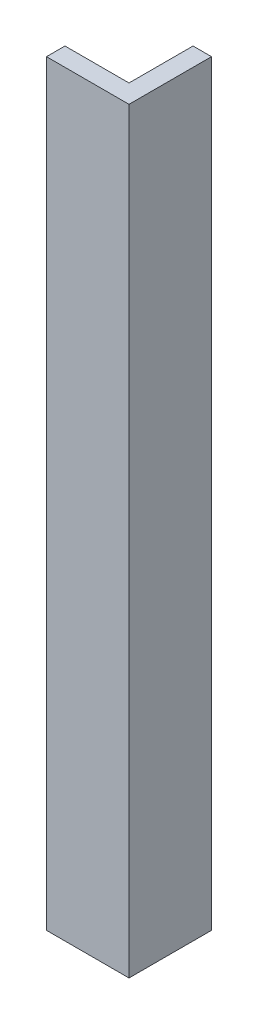
from build123d import *

# Parameters (mm, degrees)
BOSS_EXTRUDE1_DEPTH = 130


with BuildPart() as part:
    # Sketch1 → Boss-Extrude1 (new body)
    with BuildSketch(Plane(origin=(0, 0, 0), x_dir=(1, 0, 0), z_dir=(0, 1, 0))):
        Polygon((-3.175, 3.175), (-14.175, 3.175), (-14.175, 0), (0, 0), (0, 14.175), (-3.175, 14.175), align=None)
    extrude(amount=BOSS_EXTRUDE1_DEPTH)


solid = part.part
